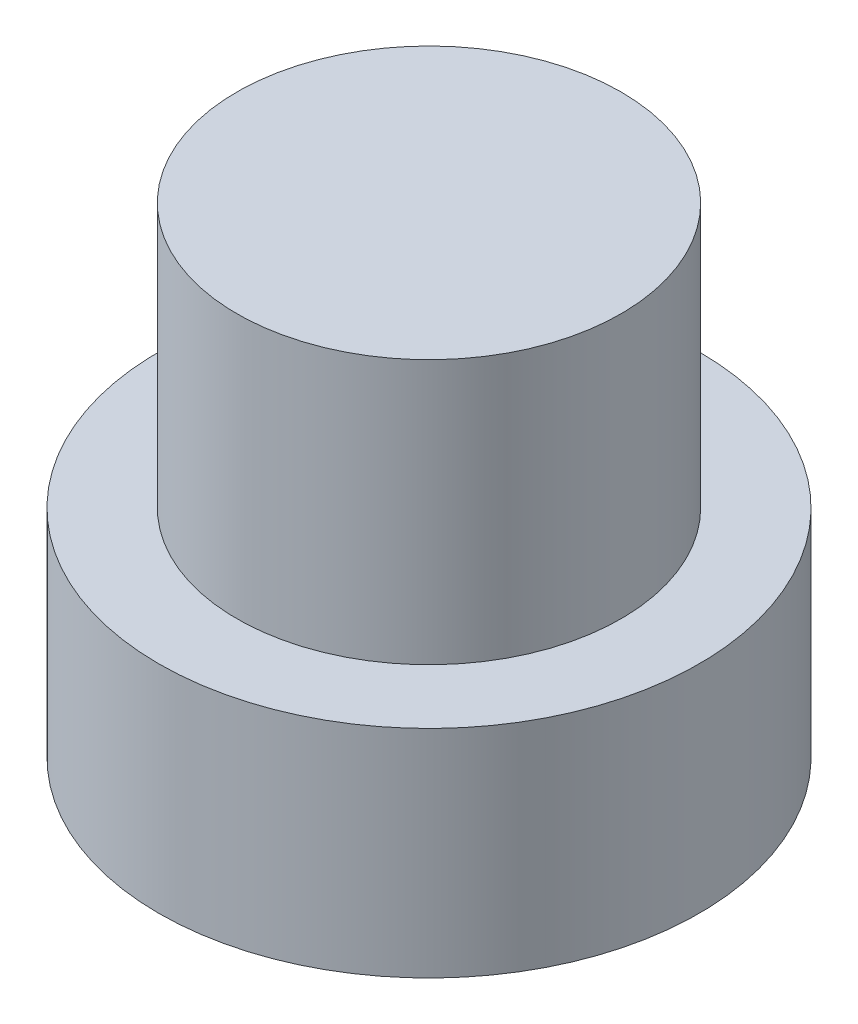
from build123d import *


with BuildPart() as part:
    # Sketch1 → Revolve1 (revolve)
    with BuildSketch(Plane.XY, mode=Mode.PRIVATE) as revolve1_sk:
        Polygon((0, 0), (22.5, 0), (22.5, 18), (16, 18), (16, 40), (0, 40), (0, 38.5), (1.5, 38.5), (14.5, 38.5), (14.5, 16.5), (21, 16.5), (21, 1.5), (1.5, 1.5), (0, 1.5), align=None)
    revolve(revolve1_sk.sketch.rotate(Axis((0, 0, 0), (0, 1, 0)), 90), axis=Axis((0, 0, 0), (0, 1, 0)))


solid = part.part
